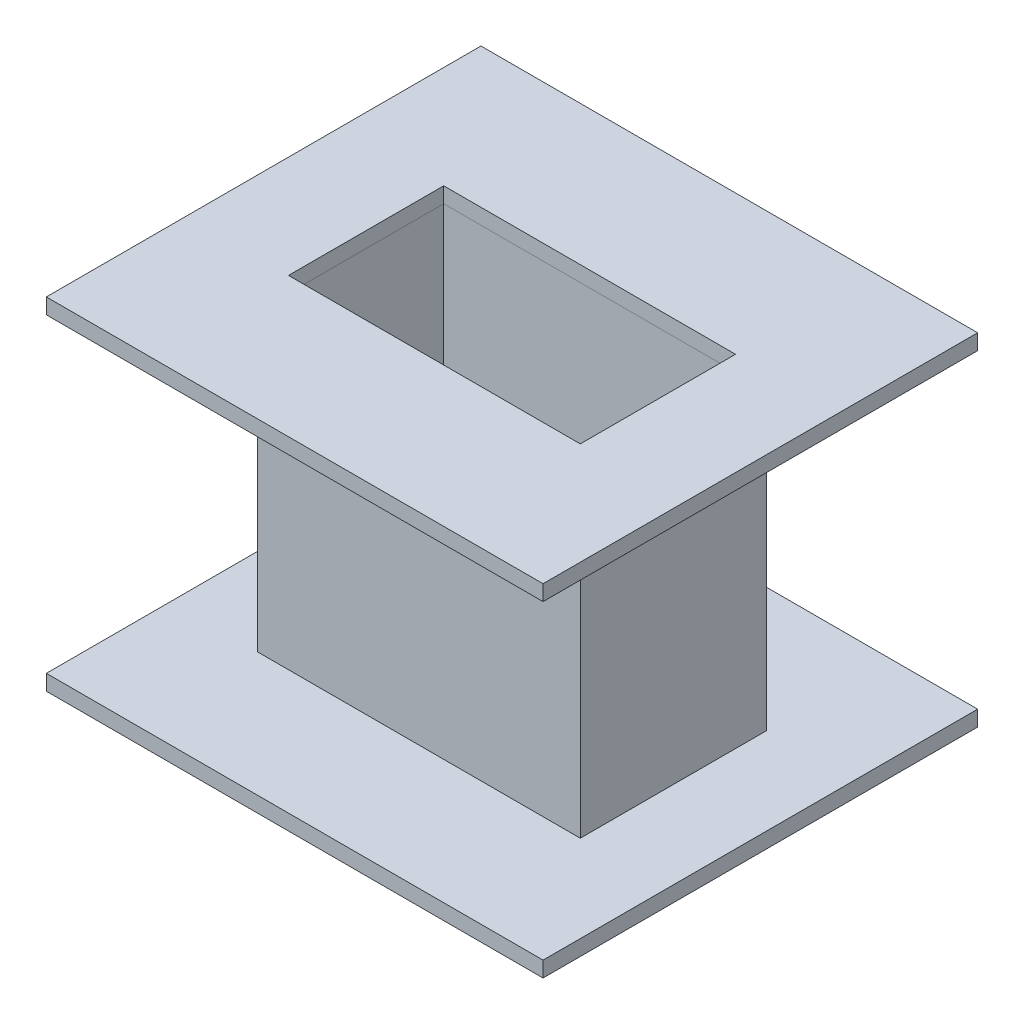
from build123d import *

# Parameters (mm, degrees)
SKETCH1_W           = 52
SKETCH1_H           = 30
SKETCH1_W_2         = 47
SKETCH1_H_2         = 25
BOSS_EXTRUDE1_DEPTH = 25
SKETCH2_W           = 80
SKETCH2_H           = 70
BOSS_EXTRUDE2_DEPTH = 2.5
SKETCH3_W           = 47
SKETCH3_H           = 25
CUT_EXTRUDE2_DEPTH  = 90


with BuildPart() as part:
    # Sketch1 → Boss-Extrude1 (new, symmetric)
    with BuildSketch(Plane(origin=(0, 0, 0), x_dir=(1, 0, 0), z_dir=(0, 1, 0))):
        Rectangle(SKETCH1_W, SKETCH1_H)
        Rectangle(SKETCH1_W_2, SKETCH1_H_2, mode=Mode.SUBTRACT)
    extrude(amount=BOSS_EXTRUDE1_DEPTH, both=True)


with BuildPart() as body_2:
    # Sketch2 → Boss-Extrude2 (new body)
    with BuildSketch(Plane(origin=(0, 25, 0), x_dir=(1, 0, 0), z_dir=(0, 1, 0))):
        Rectangle(SKETCH2_W, SKETCH2_H)
    boss_extrude2 = extrude(amount=BOSS_EXTRUDE2_DEPTH)


with BuildPart() as part_1:
    add(part.part)

    # Mirror2: Boss-Extrude2 across plane
    add(boss_extrude2.mirror(Plane.ZX))


with BuildPart() as cut_extrude2_tool:
    # Sketch3 → Cut-Extrude2 (new body)
    with BuildSketch(Plane(origin=(0, 27.5, 0), x_dir=(1, 0, 0), z_dir=(0, 1, 0))):
        Rectangle(SKETCH3_W, SKETCH3_H)
    extrude(amount=-CUT_EXTRUDE2_DEPTH)


with BuildPart() as part_2:
    add(part_1.part)

    # Cut-Extrude2: cut by cut_extrude2_tool
    add(cut_extrude2_tool.part, mode=Mode.SUBTRACT)


with BuildPart() as body_2_1:
    add(body_2.part)

    # Cut-Extrude2: cut by cut_extrude2_tool
    add(cut_extrude2_tool.part, mode=Mode.SUBTRACT)


solid = Compound([part_2.part, body_2_1.part])
